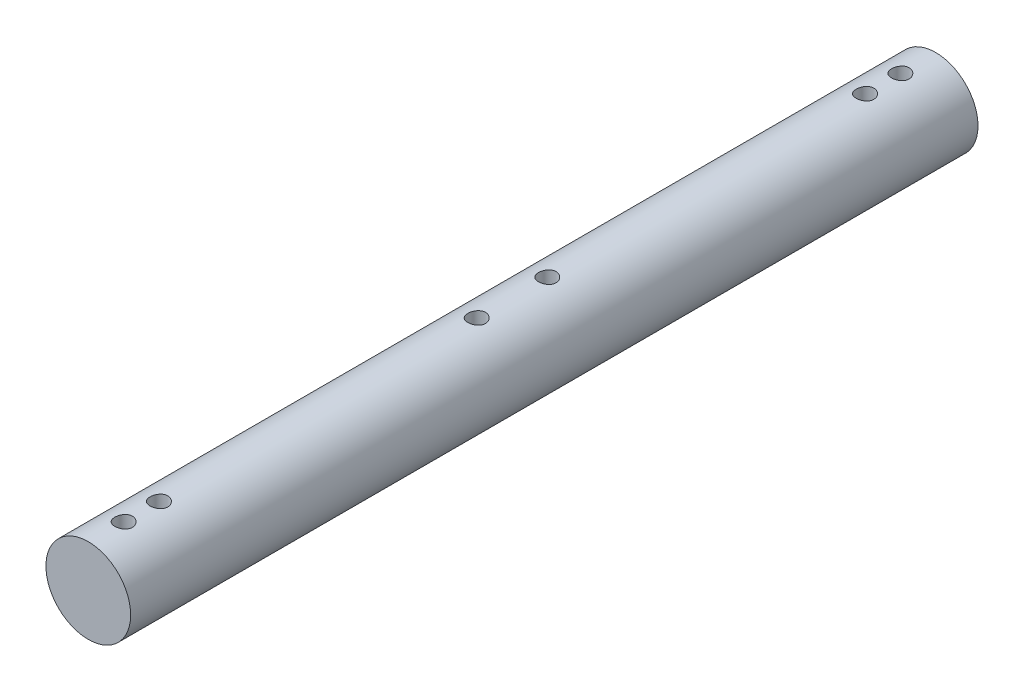
from build123d import *

# Parameters (mm, degrees)
SKETCH1_R               = 6
BOSS_EXTRUDE1_DEPTH     = 120
CUT_EXTRUDE2_DEPTH      = 121.299625935
CUT_EXTRUDE2_DEPTH_BACK = 121.299625935
SKETCH12_R              = 1.25


with BuildPart() as part:
    # Sketch1 → Boss-Extrude1 (new body)
    with BuildSketch(Plane.XY):
        Circle(SKETCH1_R)
    extrude(amount=BOSS_EXTRUDE1_DEPTH)

    # Sketch12 → Cut-Extrude2 (cut, two sides: drawn at the far end of the back side and taken through both)
    with BuildSketch(Plane(origin=(0, 0, 0), x_dir=(1, 0, 0), z_dir=(0, 1, 0)).offset(-CUT_EXTRUDE2_DEPTH_BACK)):
        with Locations(Location((0, -5, 0), (0, 0, 270))):
            Circle(SKETCH12_R)
        with Locations(Location((0, -10, 0), (0, 0, 270))):
            Circle(SKETCH12_R)
        with Locations(Location((0, -65, 0), (0, 0, 270))):
            Circle(SKETCH12_R)
        with Locations(Location((0, -55, 0), (0, 0, 270))):
            Circle(SKETCH12_R)
        with Locations(Location((0, -110, 0), (0, 0, 270))):
            Circle(SKETCH12_R)
        with Locations(Location((0, -115, 0), (0, 0, 270))):
            Circle(SKETCH12_R)
    extrude(amount=CUT_EXTRUDE2_DEPTH + CUT_EXTRUDE2_DEPTH_BACK, mode=Mode.SUBTRACT)


solid = part.part
